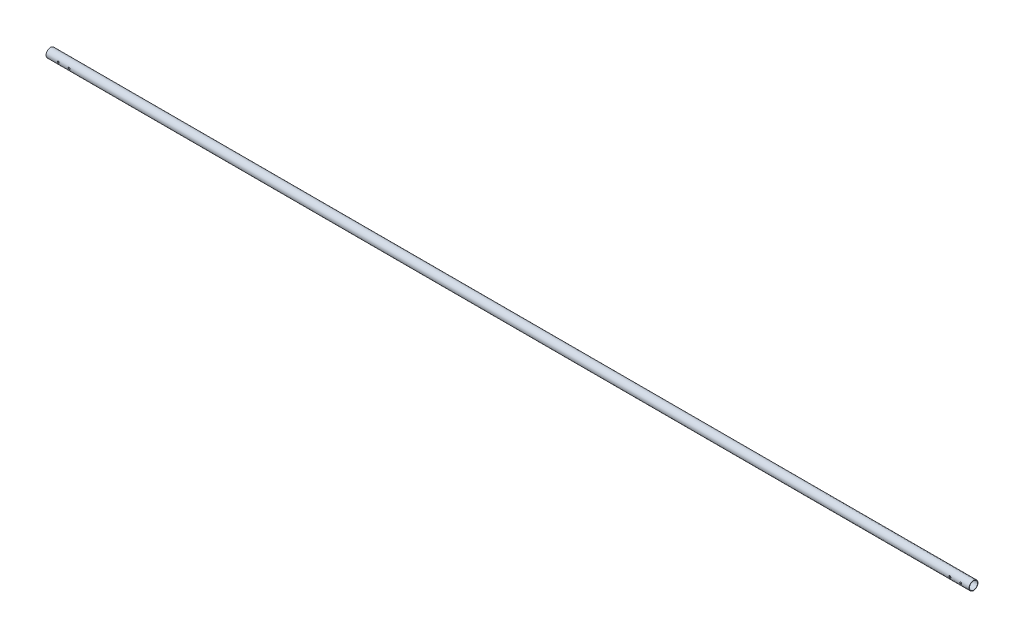
from build123d import *

# Parameters (mm, degrees)
SKETCH3_R               = 14.7701
SKETCH3_R_2             = 13.3223
BOSS_EXTRUDE1_DEPTH     = 3048
CUT_EXTRUDE1_DEPTH      = 3049.071572603
CUT_EXTRUDE1_DEPTH_BACK = 3049.071572603
SKETCH4_R               = 3.175


with BuildPart() as part:
    # Sketch3 → Boss-Extrude1 (new body)
    with BuildSketch(Plane(origin=(0, 0, 0), x_dir=(0, 0, -1), z_dir=(1, 0, 0))):
        Circle(SKETCH3_R)
        Circle(SKETCH3_R_2, mode=Mode.SUBTRACT)
    extrude(amount=BOSS_EXTRUDE1_DEPTH)

    # Sketch4 → Cut-Extrude1 (cut, two sides: drawn at the far end of the back side and taken through both)
    with BuildSketch(Plane.XY.offset(-CUT_EXTRUDE1_DEPTH_BACK)):
        with Locations((40.386, 0)):
            Circle(SKETCH4_R)
        with Locations((76.2, 0)):
            Circle(SKETCH4_R)
        with Locations((3020.314, 0)):
            Circle(SKETCH4_R)
        with Locations((2984.5, 0)):
            Circle(SKETCH4_R)
    extrude(amount=CUT_EXTRUDE1_DEPTH + CUT_EXTRUDE1_DEPTH_BACK, mode=Mode.SUBTRACT)


solid = part.part
